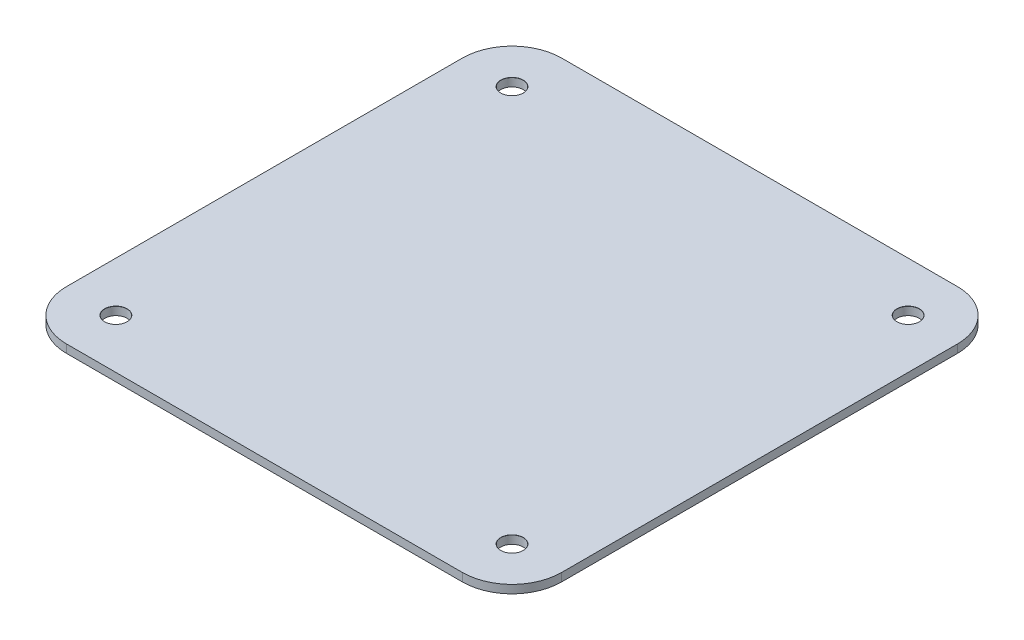
from build123d import *

# Parameters (mm, degrees)
SKETCH1_W                      = 100
SKETCH1_H                      = 100
BOSS_EXTRUDE1_DEPTH            = 1.66
FILLET1_R                      = 10
M4_CLEARANCE_HOLE1_D           = 4.5
M4_CLEARANCE_HOLE1_DEPTH       = 22.648063607
M4_CLEARANCE_HOLE1_CSINK_D     = 4.55
M4_CLEARANCE_HOLE1_CSINK_ANGLE = 90
M4_CLEARANCE_HOLE1_TIP         = 1.351936393


with BuildPart() as part:
    # Sketch1 → Boss-Extrude1 (new body)
    with BuildSketch(Plane(origin=(0, 0, 0), x_dir=(1, 0, 0), z_dir=(0, 1, 0))):
        Rectangle(SKETCH1_W, SKETCH1_H)
    extrude(amount=BOSS_EXTRUDE1_DEPTH)

    # Fillet1
    fillet1_edges = [part.edges().sort_by_distance(p)[0] for p in [
        (50, 0.83, 50),
        (-50, 0.83, 50),
        (-50, 0.83, -50),
        (50, 0.83, -50),
    ]]
    fillet(fillet1_edges, radius=FILLET1_R)

    # M4 Clearance Hole1
    with Locations(Plane(origin=(0, 1.66, 0), x_dir=(1, 0, 0), z_dir=(0, 1, 0))):
        with Locations((-40, 40), (-40, -40), (40, -40), (40, 40)):
            CounterSinkHole(M4_CLEARANCE_HOLE1_D / 2, M4_CLEARANCE_HOLE1_CSINK_D / 2, depth=M4_CLEARANCE_HOLE1_DEPTH, counter_sink_angle=M4_CLEARANCE_HOLE1_CSINK_ANGLE)
            with Locations((0, 0, -(M4_CLEARANCE_HOLE1_DEPTH + M4_CLEARANCE_HOLE1_TIP / 2))):  # 118° drill point
                Cone(0, M4_CLEARANCE_HOLE1_D / 2, M4_CLEARANCE_HOLE1_TIP, mode=Mode.SUBTRACT)


solid = part.part
